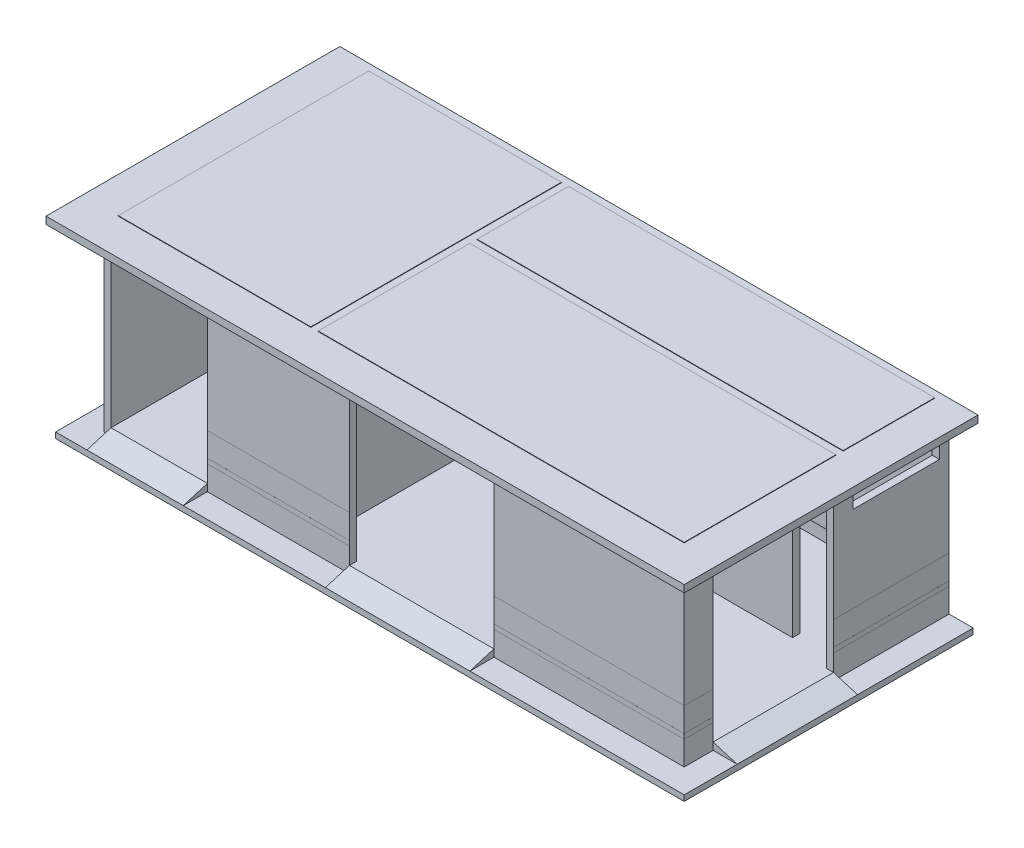
from build123d import *

# Parameters (mm, degrees)
CROQUIS1_W                 = 7900
CROQUIS1_H                 = 3730
SALIENTE_EXTRUIR1_DEPTH    = 5500
CROQUIS2_W                 = 7600
CROQUIS2_H                 = 5200
CORTAR_EXTRUIR1_DEPTH      = 3250
CROQUIS3_W                 = 7600
CROQUIS3_H                 = 150
SALIENTE_EXTRUIR2_DEPTH    = 3250
CROQUIS4_W                 = 800
CROQUIS4_H                 = 2300
CORTAR_EXTRUIR2_DEPTH      = 150
CROQUIS7_W                 = 5500
CROQUIS7_H                 = 3730
SALIENTE_EXTRUIR4_DEPTH    = 4150
CROQUIS8_W                 = 4000
CROQUIS8_H                 = 5200
CORTAR_EXTRUIR3_DEPTH      = 3250
CROQUIS10_W                = 900
CROQUIS10_H                = 150
CORTAR_EXTRUIR5_DEPTH      = 2300
CROQUIS11_W                = 2500
CROQUIS11_H                = 3400
CORTAR_EXTRUIR6_DEPTH      = 150
CROQUIS12_W                = 1800
CROQUIS12_H                = 800
CORTAR_EXTRUIR7_DEPTH      = 150
CROQUIS13_W                = 3000
CROQUIS13_H                = 3400
CORTAR_EXTRUIR8_DEPTH      = 150
CROQUIS15_W                = 1800
CROQUIS15_H                = 800
CORTAR_EXTRUIR10_DEPTH     = 150
CROQUIS16_W                = 2000
CROQUIS16_H                = 2300
CORTAR_EXTRUIR11_DEPTH     = 150
CROQUIS17_W                = 12050
CROQUIS17_H                = 150
SALIENTE_EXTRUIR5_DEPTH    = 600
CROQUIS18_W                = 6100
CROQUIS18_H                = 150
SALIENTE_EXTRUIR6_DEPTH    = 600
CROQUIS19_W                = 6100
CROQUIS19_H                = 150
SALIENTE_EXTRUIR7_DEPTH    = 600
CROQUIS20_W                = 7600
CROQUIS20_H                = 1900
CROQUIS20_H_2              = 3150
CROQUIS20_W_2              = 4000
CROQUIS20_H_3              = 5200
CORTAR_EXTRUIR12_DEPTH     = 1280
CROQUIS21_W                = 2000
CROQUIS21_H                = 3400
CORTAR_EXTRUIR13_DEPTH     = 150
CROQUIS24_W                = 2000
CROQUIS24_H                = 2300
SALIENTE_EXTRUIR11_DEPTH   = 150
CROQUIS25_W                = 1800
CROQUIS25_H                = 400
CORTAR_EXTRUIR14_DEPTH     = 170
CROQUIS26_W                = 12050
CROQUIS26_H                = 5500
SALIENTE_EXTRUIR12_DEPTH   = 270
SALIENTE_EXTRUIR13_DEPTH   = 120
CROQUIS33_W                = 2500
CROQUIS33_H                = 150
SALIENTE_EXTRUIR19_DEPTH   = 500
CROQUIS34_W                = 2000
CROQUIS34_H                = 150
CROQUIS34_W_2              = 3000
SALIENTE_EXTRUIR20_DEPTH   = 500
CORTAR_EXTRUIR15_REACH     = 14073.895
CORTAR_EXTRUIR16_DEPTH     = 2500
CROQUIS37_W                = 5500
CROQUIS37_H                = 500
CORTAR_EXTRUIR17_DEPTH     = 0.1
CROQUIS38_W                = 2950
CROQUIS38_H                = 500
CROQUIS38_W_2              = 3950
CORTAR_EXTRUIR18_DEPTH     = 0.1
CROQUIS40_W                = 2400
CROQUIS40_H                = 500
CORTAR_EXTRUIR21_DEPTH     = 0.1
CROQUIS42_W                = 5500
CROQUIS42_H                = 858.801282929
CORTAR_EXTRUIR24_DEPTH     = 0.1
CROQUIS43_W                = 2950
CROQUIS43_H                = 500
CROQUIS43_W_2              = 3950
CORTAR_EXTRUIR25_DEPTH     = 0.1
CROQUIS44_W                = 599.9
CROQUIS44_H                = 500
CROQUIS44_W_2              = 2400
CROQUIS44_H_2              = 499.99998
CORTAR_EXTRUIR26_DEPTH     = 0.1
CROQUIS47_W                = 1200
CROQUIS47_H                = 2300
CORTAR_EXTRUIR28_DEPTH     = 150
CROQUIS48_W                = 1800
CROQUIS48_H                = 800
CORTAR_EXTRUIR29_DEPTH     = 150
CROQUIS50_W                = 944
CROQUIS50_H                = 600
CORTAR_EXTRUIR30_DEPTH     = 150
CROQUIS51_W                = 7600
CROQUIS51_H                = 3150
SALIENTE_EXTRUIR22_DEPTH   = 10
CROQUIS51_H_2              = 1900
SALIENTE_EXTRUIR22_2_DEPTH = 10
CROQUIS51_W_2              = 4000
CROQUIS51_H_3              = 5200
SALIENTE_EXTRUIR22_3_DEPTH = 10
CROQUIS53_R                = 100
CROQUIS53_W                = 40
CROQUIS53_H                = 900
SALIENTE_EXTRUIR23_DEPTH   = 40
REDONDEO1_R                = 16
CROQUIS54_R                = 100
CROQUIS54_W                = 40
CROQUIS54_H                = 1150
SALIENTE_EXTRUIR24_DEPTH   = 40
REDONDEO2_R                = 16
CROQUIS55_R                = 100
CROQUIS55_W                = 40
CROQUIS55_H                = 900
CROQUIS55_W_2              = 850
CROQUIS55_H_2              = 40
SALIENTE_EXTRUIR25_DEPTH   = 40
CROQUIS56_W                = 40
CROQUIS56_H                = 900
CROQUIS56_W_2              = 900
CROQUIS56_H_2              = 40
CROQUIS56_H_3              = 872.376052144
SALIENTE_EXTRUIR26_DEPTH   = 40
REDONDEO3_R                = 16


with BuildPart() as part:
    # Croquis1 → Saliente-Extruir1 (new body)
    with BuildSketch(Plane.XY):
        Rectangle(CROQUIS1_W, CROQUIS1_H)
    extrude(amount=SALIENTE_EXTRUIR1_DEPTH)

    # Croquis2 → Cortar-Extruir1 (cut)
    with BuildSketch(Plane.XZ.offset(1865)):
        with Locations((0, 2750)):
            Rectangle(CROQUIS2_W, CROQUIS2_H)
    extrude(amount=-CORTAR_EXTRUIR1_DEPTH, mode=Mode.SUBTRACT)

    # Croquis3 → Saliente-Extruir2 (add)
    with BuildSketch(Plane.XZ.offset(1865)):
        with Locations((0, 2125)):
            Rectangle(CROQUIS3_W, CROQUIS3_H)
    extrude(amount=-SALIENTE_EXTRUIR2_DEPTH)

    # Croquis4 → Cortar-Extruir2 (cut)
    with BuildSketch(Plane.ZY.offset(3950)):
        with Locations((550, -715)):
            Rectangle(CROQUIS4_W, CROQUIS4_H)
    extrude(amount=-CORTAR_EXTRUIR2_DEPTH, mode=Mode.SUBTRACT)

    # Croquis7 → Saliente-Extruir4 (add)
    with BuildSketch(Plane.ZY.offset(3950)):
        with Locations((2750, 0)):
            Rectangle(CROQUIS7_W, CROQUIS7_H)
    extrude(amount=SALIENTE_EXTRUIR4_DEPTH)

    # Croquis8 → Cortar-Extruir3 (cut)
    with BuildSketch(Plane.XZ.offset(1865)):
        with Locations((-5950, 2750)):
            Rectangle(CROQUIS8_W, CROQUIS8_H)
    extrude(amount=-CORTAR_EXTRUIR3_DEPTH, mode=Mode.SUBTRACT)

    # Croquis10 → Cortar-Extruir5 (cut)
    with BuildSketch(Plane.XZ.offset(1865)):
        with Locations((3350, 2125)):
            Rectangle(CROQUIS10_W, CROQUIS10_H)
    extrude(amount=-CORTAR_EXTRUIR5_DEPTH, mode=Mode.SUBTRACT)

    # Croquis11 → Cortar-Extruir6 (cut)
    with BuildSketch(Plane(origin=(3950, 0, 0), x_dir=(0, 0, -1), z_dir=(1, 0, 0))):
        with Locations((-3650, -165)):
            Rectangle(CROQUIS11_W, CROQUIS11_H)
    extrude(amount=-CORTAR_EXTRUIR6_DEPTH, mode=Mode.SUBTRACT)

    # Croquis12 → Cortar-Extruir7 (cut)
    with BuildSketch(Plane(origin=(3950, 0, 0), x_dir=(0, 0, -1), z_dir=(1, 0, 0))):
        with Locations((-1100, 1265)):
            Rectangle(CROQUIS12_W, CROQUIS12_H)
    extrude(amount=-CORTAR_EXTRUIR7_DEPTH, mode=Mode.SUBTRACT)

    # Croquis13 → Cortar-Extruir8 (cut)
    with BuildSketch(Plane.XY.offset(5500)):
        with Locations((-1500, -165)):
            Rectangle(CROQUIS13_W, CROQUIS13_H)
    extrude(amount=-CORTAR_EXTRUIR8_DEPTH, mode=Mode.SUBTRACT)

    # Croquis15 → Cortar-Extruir10 (cut)
    with BuildSketch(Plane.ZY.offset(8100)):
        with Locations((1100, 1265)):
            Rectangle(CROQUIS15_W, CROQUIS15_H)
    extrude(amount=-CORTAR_EXTRUIR10_DEPTH, mode=Mode.SUBTRACT)

    # Croquis16 → Cortar-Extruir11 (cut)
    with BuildSketch(Plane(origin=(0, 0, 0), x_dir=(-1, 0, 0), z_dir=(0, 0, -1))):
        with Locations((5950, -715)):
            Rectangle(CROQUIS16_W, CROQUIS16_H)
    extrude(amount=-CORTAR_EXTRUIR11_DEPTH, mode=Mode.SUBTRACT)

    # Croquis17 → Saliente-Extruir5 (add)
    with BuildSketch(Plane.XY.offset(5500)):
        with Locations((-2075, 1790)):
            Rectangle(CROQUIS17_W, CROQUIS17_H)
    extrude(amount=SALIENTE_EXTRUIR5_DEPTH)

    # Croquis18 → Saliente-Extruir6 (add)
    with BuildSketch(Plane(origin=(3950, 0, 0), x_dir=(0, 0, -1), z_dir=(1, 0, 0))):
        with Locations((-3050, 1790)):
            Rectangle(CROQUIS18_W, CROQUIS18_H)
    extrude(amount=SALIENTE_EXTRUIR6_DEPTH)

    # Croquis19 → Saliente-Extruir7 (add)
    with BuildSketch(Plane.ZY.offset(8100)):
        with Locations((3050, 1790)):
            Rectangle(CROQUIS19_W, CROQUIS19_H)
    extrude(amount=SALIENTE_EXTRUIR7_DEPTH)

    # Croquis20 → Cortar-Extruir12 (cut)
    with BuildSketch(Plane.XZ.offset(-1385)):
        with Locations((0, 1100)):
            Rectangle(CROQUIS20_W, CROQUIS20_H)
        with Locations((0, 3775)):
            Rectangle(CROQUIS20_W, CROQUIS20_H_2)
        with Locations((-5950, 2750)):
            Rectangle(CROQUIS20_W_2, CROQUIS20_H_3)
    extrude(amount=-CORTAR_EXTRUIR12_DEPTH, mode=Mode.SUBTRACT)

    # Croquis21 → Cortar-Extruir13 (cut)
    with BuildSketch(Plane.XY.offset(5500)):
        with Locations((-6950, -165)):
            Rectangle(CROQUIS21_W, CROQUIS21_H)
    extrude(amount=-CORTAR_EXTRUIR13_DEPTH, mode=Mode.SUBTRACT)

    # Croquis24 → Saliente-Extruir11 (add)
    with BuildSketch(Plane(origin=(0, 0, 0), x_dir=(-1, 0, 0), z_dir=(0, 0, -1))):
        with Locations((5950, -715)):
            Rectangle(CROQUIS24_W, CROQUIS24_H)
    extrude(amount=-SALIENTE_EXTRUIR11_DEPTH)

    # Croquis25 → Cortar-Extruir14 (cut)
    with BuildSketch(Plane(origin=(-3800, 0, 0), x_dir=(0, 0, -1), z_dir=(1, 0, 0))):
        with Locations((-1100, 1465)):
            Rectangle(CROQUIS25_W, CROQUIS25_H)
    extrude(amount=-CORTAR_EXTRUIR14_DEPTH, mode=Mode.SUBTRACT)

    # Croquis26 → Saliente-Extruir12 (add)
    with BuildSketch(Plane.XZ.offset(1865)):
        with Locations((-2075, 2750)):
            Rectangle(CROQUIS26_W, CROQUIS26_H)
    extrude(amount=SALIENTE_EXTRUIR12_DEPTH)



with BuildPart() as body_2:
    # Croquis27 → Saliente-Extruir13 (new body)
    with BuildSketch(Plane.XZ.offset(2135)):
        Polygon((-8100, 0), (-8100, 5500), (3950, 5500), (3950, 0), (4450, 0), (4450, 6000), (-8600, 6000), (-8600, 0), align=None)
    extrude(amount=-SALIENTE_EXTRUIR13_DEPTH)


with BuildPart() as part_1:
    add(part.part)

    add(body_2.part)  # Saliente-Extruir19 merges body 2
    # Croquis33 → Saliente-Extruir19 (add)
    with BuildSketch(Plane(origin=(3950, 0, 0), x_dir=(0, 0, -1), z_dir=(1, 0, 0))):
        with Locations((-3650, -1940)):
            Rectangle(CROQUIS33_W, CROQUIS33_H)
    extrude(amount=SALIENTE_EXTRUIR19_DEPTH)

    # Croquis34 → Saliente-Extruir20 (add)
    with BuildSketch(Plane.XY.offset(5500)):
        with Locations((-6950, -1940)):
            Rectangle(CROQUIS34_W, CROQUIS34_H)
        with Locations((-1500, -1940)):
            Rectangle(CROQUIS34_W_2, CROQUIS34_H)
    extrude(amount=SALIENTE_EXTRUIR20_DEPTH)

    # Cortar-Extruir15: up to this face of the body (flat: up to its plane)
    cortar_extruir15_end = Plane(part_1.part.faces().sort_by_distance((0, -1940, 5750))[0])
    # Croquis35 → Cortar-Extruir15 (cut, up to the picked face)
    with BuildSketch(Plane.ZY.offset(7950), mode=Mode.PRIVATE) as cortar_extruir15_sk1:
        Polygon((6000, -2015), (5500, -1865), (6000, -1865), align=None)
    cortar_extruir15_tool1 = split(extrude(cortar_extruir15_sk1.sketch, amount=-CORTAR_EXTRUIR15_REACH, mode=Mode.PRIVATE), bisect_by=cortar_extruir15_end, keep=Keep.BOTH, mode=Mode.PRIVATE)
    add(cortar_extruir15_tool1.solids().sort_by(Axis((-7950, -1915, 5833.333333), (1, 0, 0)))[0], mode=Mode.SUBTRACT)

    # Croquis36 → Cortar-Extruir16 (cut)
    with BuildSketch(Plane(origin=(0, 0, 2400), x_dir=(-1, 0, 0), z_dir=(0, 0, -1))):
        Polygon((-4450, -1865), (-3950, -1865), (-4450, -2015), align=None)
    extrude(amount=-CORTAR_EXTRUIR16_DEPTH, mode=Mode.SUBTRACT)

    # Croquis37 → Cortar-Extruir17 (cut)
    with BuildSketch(Plane.ZY.offset(8100)):
        with Locations((2750, -1765)):
            Rectangle(CROQUIS37_W, CROQUIS37_H)
    extrude(amount=-CORTAR_EXTRUIR17_DEPTH, mode=Mode.SUBTRACT)

    # Croquis38 → Cortar-Extruir18 (cut)
    with BuildSketch(Plane.XY.offset(5500)):
        with Locations((-4475, -1765)):
            Rectangle(CROQUIS38_W, CROQUIS38_H)
        with Locations((1975, -1765)):
            Rectangle(CROQUIS38_W_2, CROQUIS38_H)
    extrude(amount=-CORTAR_EXTRUIR18_DEPTH, mode=Mode.SUBTRACT)

    # Croquis40 → Cortar-Extruir21 (cut)
    with BuildSketch(Plane(origin=(3950, 0, 0), x_dir=(0, 0, -1), z_dir=(1, 0, 0))):
        with Locations((-1200, -1765)):
            Rectangle(CROQUIS40_W, CROQUIS40_H)
        Polygon((-4900, -2015), (-4900, -1515.00001), (-5500, -1515.00001), (-5499.9, -2015), align=None)
    extrude(amount=-CORTAR_EXTRUIR21_DEPTH, mode=Mode.SUBTRACT)

    # Croquis42 → Cortar-Extruir24 (cut)
    with BuildSketch(Plane.ZY.offset(8100)):
        with Locations((2750, -985.599358535)):
            Rectangle(CROQUIS42_W, CROQUIS42_H)
    extrude(amount=-CORTAR_EXTRUIR24_DEPTH, mode=Mode.SUBTRACT)

    # Croquis43 → Cortar-Extruir25 (cut)
    with BuildSketch(Plane.XY.offset(5500)):
        with Locations((-4475, -1165)):
            Rectangle(CROQUIS43_W, CROQUIS43_H)
        with Locations((1975, -1165)):
            Rectangle(CROQUIS43_W_2, CROQUIS43_H)
    extrude(amount=-CORTAR_EXTRUIR25_DEPTH, mode=Mode.SUBTRACT)

    # Croquis44 → Cortar-Extruir26 (cut)
    with BuildSketch(Plane(origin=(3950, 0, 0), x_dir=(0, 0, -1), z_dir=(1, 0, 0))):
        with Locations((-5199.95, -1165.00001)):
            Rectangle(CROQUIS44_W, CROQUIS44_H)
        with Locations((-1200, -1165.00001)):
            Rectangle(CROQUIS44_W_2, CROQUIS44_H_2)
    extrude(amount=-CORTAR_EXTRUIR26_DEPTH, mode=Mode.SUBTRACT)

    # Croquis47 → Cortar-Extruir28 (cut)
    with BuildSketch(Plane(origin=(0, 0, 0), x_dir=(-1, 0, 0), z_dir=(0, 0, -1))):
        with Locations((3200, -715)):
            Rectangle(CROQUIS47_W, CROQUIS47_H)
    extrude(amount=-CORTAR_EXTRUIR28_DEPTH, mode=Mode.SUBTRACT)

    # Croquis48 → Cortar-Extruir29 (cut)
    with BuildSketch(Plane.ZY.offset(8100)):
        with Locations((3750, 1265)):
            Rectangle(CROQUIS48_W, CROQUIS48_H)
    extrude(amount=-CORTAR_EXTRUIR29_DEPTH, mode=Mode.SUBTRACT)

    # Croquis50 → Cortar-Extruir30 (cut)
    with BuildSketch(Plane.XY.offset(2200)):
        with Locations((-1612, 345)):
            Rectangle(CROQUIS50_W, CROQUIS50_H)
        with Locations((1714, 235)):
            Rectangle(CROQUIS50_W, CROQUIS50_H)
    extrude(amount=-CORTAR_EXTRUIR30_DEPTH, mode=Mode.SUBTRACT)

    # Croquis56 → Saliente-Extruir26 (add)
    with BuildSketch(Plane.XZ.offset(-1715)):
        with Locations((-8369.9, 1250)):
            Rectangle(CROQUIS56_W, CROQUIS56_H)
        with Locations((-8369.9, 4150)):
            Rectangle(CROQUIS56_W, CROQUIS56_H)
        with Locations((-5250, 5769.9)):
            Rectangle(CROQUIS56_W_2, CROQUIS56_H_2)
        with Locations((1100, 5770)):
            Rectangle(CROQUIS56_W_2, CROQUIS56_H_2)
        with Locations((4219.9, 1236.188026072)):
            Rectangle(CROQUIS56_W, CROQUIS56_H_3)
        with Locations((4220, 4122.376052144)):
            Rectangle(CROQUIS56_W, CROQUIS56_H)
    extrude(amount=SALIENTE_EXTRUIR26_DEPTH)

    # Redondeo3
    redondeo3_edges = [part_1.edges().sort_by_distance(p)[0] for p in [
        (-8389.9, 1695, 800),
        (-8349.9, 1695, 800),
        (-8349.9, 1695, 1700),
        (-8389.9, 1695, 1700),
        (-8369.9, 1675, 800),
        (-8349.9, 1675, 1250),
        (-8369.9, 1675, 1700),
        (-8389.9, 1675, 1250),
        (-8349.9, 1695, 4600),
        (-8389.9, 1695, 4600),
        (-8389.9, 1695, 3700),
        (-8349.9, 1695, 3700),
        (-8369.9, 1675, 4600),
        (-8389.9, 1675, 4150),
        (-8369.9, 1675, 3700),
        (-8349.9, 1675, 4150),
        (-4800, 1695, 5749.9),
        (-4800, 1695, 5789.9),
        (-5700, 1695, 5789.9),
        (-5700, 1695, 5749.9),
        (-4800, 1675, 5769.9),
        (-5250, 1675, 5789.9),
        (-5700, 1675, 5769.9),
        (-5250, 1675, 5749.9),
        (1550, 1695, 5750),
        (1550, 1695, 5790),
        (650, 1695, 5790),
        (650, 1695, 5750),
        (1550, 1675, 5770),
        (1100, 1675, 5790),
        (650, 1675, 5770),
        (1100, 1675, 5750),
        (4199.9, 1695, 800),
        (4239.9, 1695, 800),
        (4239.9, 1695, 1672.376052144),
        (4199.9, 1695, 1672.376052144),
        (4219.9, 1675, 800),
        (4239.9, 1675, 1236.188026072),
        (4219.9, 1675, 1672.376052144),
        (4199.9, 1675, 1236.188026072),
        (4240, 1695, 4572.376052144),
        (4200, 1695, 4572.376052144),
        (4200, 1695, 3672.376052144),
        (4240, 1695, 3672.376052144),
        (4220, 1675, 4572.376052144),
        (4200, 1675, 4122.376052144),
        (4220, 1675, 3672.376052144),
        (4240, 1675, 4122.376052144),
    ]]
    fillet(redondeo3_edges, radius=REDONDEO3_R)


with BuildPart() as body_2_2:
    # Croquis51 → Saliente-Extruir22 (new body)
    with BuildSketch(Plane(origin=(0, 1865, 0), x_dir=(1, 0, 0), z_dir=(0, 1, 0))):
        with Locations((0, -3775)):
            Rectangle(CROQUIS51_W, CROQUIS51_H)
    extrude(amount=SALIENTE_EXTRUIR22_DEPTH)

    # Croquis54 → Saliente-Extruir24 (add)
    with BuildSketch(Plane.XZ.offset(-1865)):
        with Locations(Location((-1870, 4275, 0), (0, 0, 270))):
            Circle(CROQUIS54_R)
        with Locations(Location((-30, 4275, 0), (0, 0, 270))):
            Circle(CROQUIS54_R)
        with Locations(Location((1810, 4275, 0), (0, 0, 270))):
            Circle(CROQUIS54_R)
        with Locations((-2790, 4275)):
            Rectangle(CROQUIS54_W, CROQUIS54_H)
        with Locations((-950, 4275)):
            Rectangle(CROQUIS54_W, CROQUIS54_H)
        with Locations((890, 4275)):
            Rectangle(CROQUIS54_W, CROQUIS54_H)
        with Locations((2730, 4275)):
            Rectangle(CROQUIS54_W, CROQUIS54_H)
    extrude(amount=SALIENTE_EXTRUIR24_DEPTH)

    # Redondeo2
    redondeo2_edges = [body_2_2.edges().sort_by_distance(p)[0] for p in [
        (-2770, 1845, 4850),
        (-2810, 1845, 4850),
        (-2810, 1845, 3700),
        (-2770, 1845, 3700),
        (-2790, 1825, 4850),
        (-2810, 1825, 4275),
        (-2790, 1825, 3700),
        (-2770, 1825, 4275),
        (-930, 1845, 4850),
        (-970, 1845, 4850),
        (-970, 1845, 3700),
        (-930, 1845, 3700),
        (-950, 1825, 4850),
        (-970, 1825, 4275),
        (-950, 1825, 3700),
        (-930, 1825, 4275),
        (910, 1845, 4850),
        (870, 1845, 4850),
        (870, 1845, 3700),
        (910, 1845, 3700),
        (890, 1825, 4850),
        (870, 1825, 4275),
        (890, 1825, 3700),
        (910, 1825, 4275),
        (2750, 1845, 4850),
        (2710, 1845, 4850),
        (2710, 1845, 3700),
        (2750, 1845, 3700),
        (2730, 1825, 4850),
        (2710, 1825, 4275),
        (2730, 1825, 3700),
        (2750, 1825, 4275),
    ]]
    fillet(redondeo2_edges, radius=REDONDEO2_R)


with BuildPart() as body_3:
    # Croquis51 → Saliente-Extruir22 2 (new body)
    with BuildSketch(Plane(origin=(0, 1865, 0), x_dir=(1, 0, 0), z_dir=(0, 1, 0))):
        with Locations((0, -1100)):
            Rectangle(CROQUIS51_W, CROQUIS51_H_2)
    extrude(amount=SALIENTE_EXTRUIR22_2_DEPTH)

    # Croquis53 → Saliente-Extruir23 (add)
    with BuildSketch(Plane.XZ.offset(-1865)):
        with Locations(Location((-1560, 850, 0), (0, 0, 270))):
            Circle(CROQUIS53_R)
        with Locations(Location((1518.749217772, 900, 0), (0, 0, 270))):
            Circle(CROQUIS53_R)
        with Locations((-2580, 850)):
            Rectangle(CROQUIS53_W, CROQUIS53_H)
        with Locations((-541.250782228, 850)):
            Rectangle(CROQUIS53_W, CROQUIS53_H)
        with Locations((498.749217772, 850)):
            Rectangle(CROQUIS53_W, CROQUIS53_H)
        with Locations((2538.749217772, 850)):
            Rectangle(CROQUIS53_W, CROQUIS53_H)
    extrude(amount=SALIENTE_EXTRUIR23_DEPTH)

    # Redondeo1
    redondeo1_edges = [body_3.edges().sort_by_distance(p)[0] for p in [
        (-2560, 1845, 1300),
        (-2600, 1845, 1300),
        (-2600, 1845, 400),
        (-2560, 1845, 400),
        (-2580, 1825, 1300),
        (-2600, 1825, 850),
        (-2580, 1825, 400),
        (-2560, 1825, 850),
        (-521.250782228, 1845, 1300),
        (-561.250782228, 1845, 1300),
        (-561.250782228, 1845, 400),
        (-521.250782228, 1845, 400),
        (-541.250782228, 1825, 1300),
        (-561.250782228, 1825, 850),
        (-541.250782228, 1825, 400),
        (-521.250782228, 1825, 850),
        (518.749217772, 1845, 1300),
        (478.749217772, 1845, 1300),
        (478.749217772, 1845, 400),
        (518.749217772, 1845, 400),
        (498.749217772, 1825, 1300),
        (478.749217772, 1825, 850),
        (498.749217772, 1825, 400),
        (518.749217772, 1825, 850),
        (2558.749217772, 1845, 1300),
        (2518.749217772, 1845, 1300),
        (2518.749217772, 1845, 400),
        (2558.749217772, 1845, 400),
        (2538.749217772, 1825, 1300),
        (2518.749217772, 1825, 850),
        (2538.749217772, 1825, 400),
        (2558.749217772, 1825, 850),
    ]]
    fillet(redondeo1_edges, radius=REDONDEO1_R)


with BuildPart() as body_4:
    # Croquis51 → Saliente-Extruir22 3 (new body)
    with BuildSketch(Plane(origin=(0, 1865, 0), x_dir=(1, 0, 0), z_dir=(0, 1, 0))):
        with Locations((-5950, -2750)):
            Rectangle(CROQUIS51_W_2, CROQUIS51_H_3)
    extrude(amount=SALIENTE_EXTRUIR22_3_DEPTH)

    # Croquis55 → Saliente-Extruir25 (add)
    with BuildSketch(Plane.XZ.offset(-1865)):
        with Locations(Location((-6950, 1870, 0), (0, 0, 270))):
            Circle(CROQUIS55_R)
        with Locations(Location((-6950, 3710, 0), (0, 0, 270))):
            Circle(CROQUIS55_R)
        with Locations((-5370, 900)):
            Rectangle(CROQUIS55_W, CROQUIS55_H)
        Polygon((-7350, 950), (-7350, 970), (-6500, 970), (-6500, 930), (-7350, 930), align=None)
        with Locations((-6925, 2790)):
            Rectangle(CROQUIS55_W_2, CROQUIS55_H_2)
        with Locations((-6925, 4630)):
            Rectangle(CROQUIS55_W_2, CROQUIS55_H_2)
    extrude(amount=SALIENTE_EXTRUIR25_DEPTH)


solid = Compound([part_1.part, body_2_2.part, body_3.part, body_4.part])
